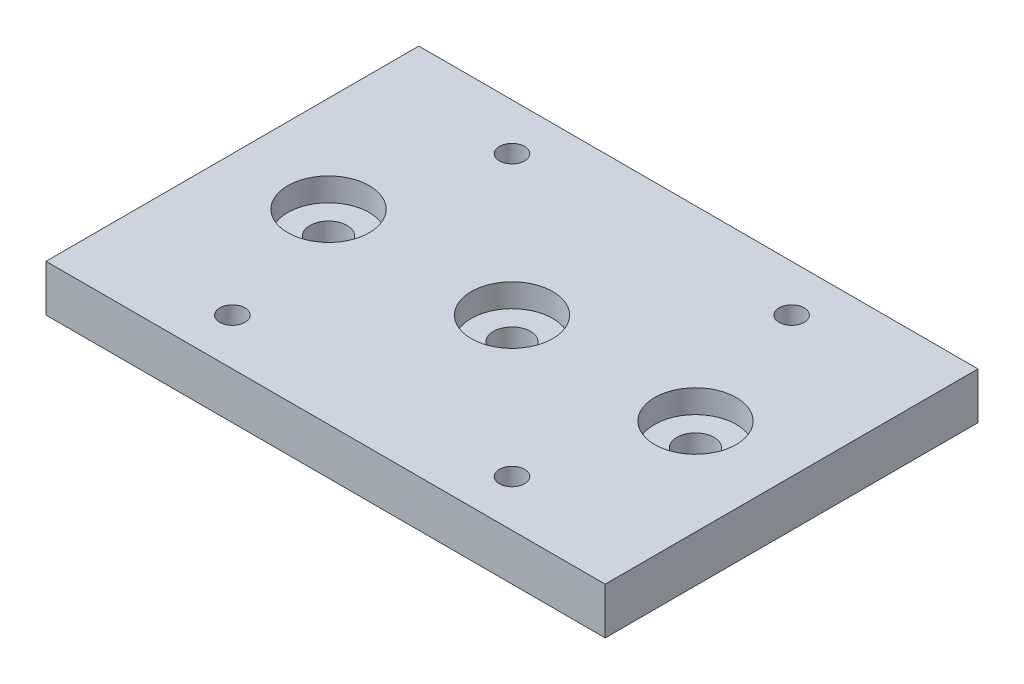
from build123d import *

# Parameters (mm, degrees)
SKETCH1_W                                = 152.4
SKETCH1_H                                = 101.6
BOSS_EXTRUDE1_DEPTH                      = 12.7
CBORE_FOR_3_8_HEX_HEAD_BOLT1_D           = 10.0838
CBORE_FOR_3_8_HEX_HEAD_BOLT1_CBORE_D     = 22.225
CBORE_FOR_3_8_HEX_HEAD_BOLT1_CBORE_DEPTH = 6.35
F_1_4_0_25_DIAMETER_HOLE2_D              = 6.858
CUT_EXTRUDE1_DEPTH                       = 6.35


with BuildPart() as part:
    # Sketch1 → Boss-Extrude1 (new body)
    with BuildSketch(Plane(origin=(0, 0, 0), x_dir=(1, 0, 0), z_dir=(0, 1, 0))):
        Rectangle(SKETCH1_W, SKETCH1_H)
    extrude(amount=BOSS_EXTRUDE1_DEPTH)

    # CBORE for 3/8 Hex Head Bolt1 (through all)
    with Locations(Plane(origin=(0, 12.7, 0), x_dir=(1, 0, 0), z_dir=(0, 1, 0))):
        with Locations((-50.000000076, 0), (50.000000076, 0), (0, 0)):
            CounterBoreHole(CBORE_FOR_3_8_HEX_HEAD_BOLT1_D / 2, CBORE_FOR_3_8_HEX_HEAD_BOLT1_CBORE_D / 2, CBORE_FOR_3_8_HEX_HEAD_BOLT1_CBORE_DEPTH)

    # 1/4 (0.25) Diameter Hole2 (through all)
    with Locations(Plane.XZ):
        with Locations((-38.1, -38.1), (38.1, -38.1), (38.1, 38.1), (-38.1, 38.1)):
            Hole(F_1_4_0_25_DIAMETER_HOLE2_D / 2)

    # Sketch6 → Cut-Extrude1 (cut)
    with BuildSketch(Plane.XZ):
        Polygon((38.170015284, -31.757905082), (32.64259233, -34.868317526), (32.572577046, -41.210412444), (38.029984716, -44.442094918), (43.55740767, -41.331682474), (43.627422954, -34.989587556), align=None)
        Polygon((-38.203510193, -31.758363325), (-43.643773559, -35.018824119), (-43.540263366, -41.360460794), (-37.996489807, -44.441636675), (-32.556226441, -41.181175881), (-32.659736634, -34.839539206), align=None)
        Polygon((-38.214534968, 44.44144714), (-43.649121804, 41.171533378), (-43.534586835, 34.830086238), (-37.985465032, 31.75855286), (-32.550878196, 35.028466622), (-32.665413165, 41.369913762), align=None)
        Polygon((38.053503852, 44.44231095), (32.584149524, 41.23088863), (32.630645672, 34.88857768), (38.146496148, 31.75768905), (43.615850476, 34.96911137), (43.569354328, 41.31142232), align=None)
    extrude(amount=-CUT_EXTRUDE1_DEPTH, mode=Mode.SUBTRACT)


solid = part.part
